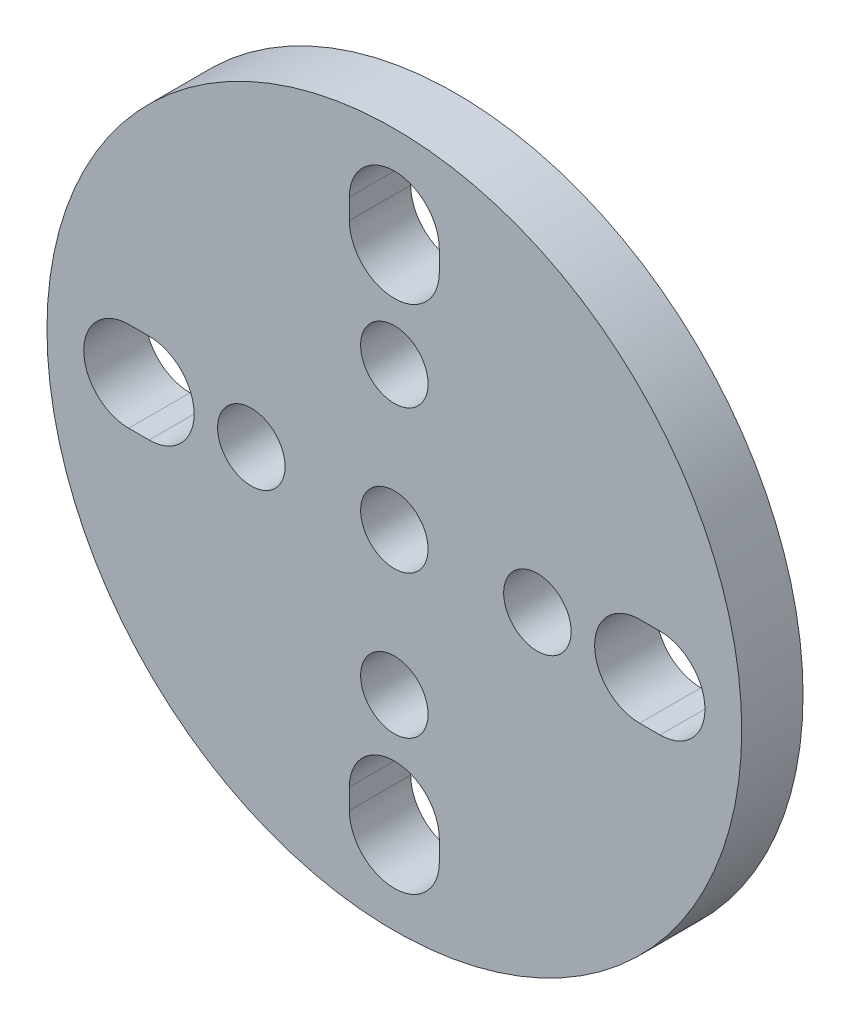
from build123d import *

# Parameters (mm, degrees)
SKETCH_1_R      = 17
SKETCH_1_R_2    = 1.65
EXTRUDE_1_DEPTH = 3


with BuildPart() as part:
    # 草图1 → 凸台-拉伸1 (new body)
    with BuildSketch(Plane.XY):
        Circle(SKETCH_1_R)
        with BuildLine():
            ThreePointArc((2.2, -13), (0, -15.2), (-2.2, -13))
            Line((-2.2, -13), (-2.2, -12))
            ThreePointArc((-2.2, -12), (0, -9.8), (2.2, -12))
            Line((2.2, -12), (2.2, -13))
        make_face(mode=Mode.SUBTRACT)
        with Locations((0, -7)):
            Circle(SKETCH_1_R_2, mode=Mode.SUBTRACT)
        with BuildLine():
            ThreePointArc((-13, -2.2), (-15.2, 0), (-13, 2.2))
            Line((-13, 2.2), (-12, 2.2))
            ThreePointArc((-12, 2.2), (-10.444365081, 1.555634919), (-9.8, 0))
            ThreePointArc((-9.8, 0), (-10.444365081, -1.555634919), (-12, -2.2))
            Line((-12, -2.2), (-13, -2.2))
        make_face(mode=Mode.SUBTRACT)
        with Locations((-7, 0)):
            Circle(SKETCH_1_R_2, mode=Mode.SUBTRACT)
        Circle(SKETCH_1_R_2, mode=Mode.SUBTRACT)
        with Locations((7, 0)):
            Circle(SKETCH_1_R_2, mode=Mode.SUBTRACT)
        with Locations((0, 7)):
            Circle(SKETCH_1_R_2, mode=Mode.SUBTRACT)
        with BuildLine():
            Line((13, -2.2), (12, -2.2))
            ThreePointArc((12, -2.2), (9.8, 0), (12, 2.2))
            Line((12, 2.2), (13, 2.2))
            ThreePointArc((13, 2.2), (14.555634919, 1.555634919), (15.2, 0))
            ThreePointArc((15.2, 0), (14.555634919, -1.555634919), (13, -2.2))
        make_face(mode=Mode.SUBTRACT)
        with BuildLine():
            Line((-2.2, 12), (-2.2, 13))
            ThreePointArc((-2.2, 13), (0, 15.2), (2.2, 13))
            Line((2.2, 13), (2.2, 12))
            ThreePointArc((2.2, 12), (0, 9.8), (-2.2, 12))
        make_face(mode=Mode.SUBTRACT)
    extrude(amount=EXTRUDE_1_DEPTH)


solid = part.part
